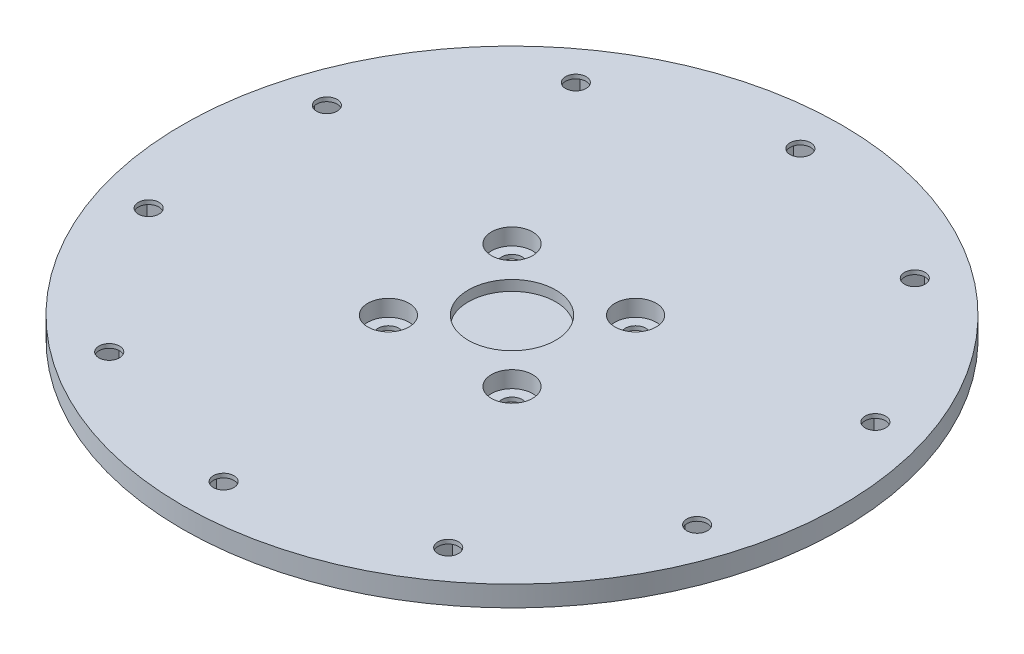
from build123d import *

# Parameters (mm, degrees)
SKETCH1_R           = 80
SKETCH1_R_2         = 2.5
BOSS_EXTRUDE1_DEPTH = 4
CUT_EXTRUDE1_DEPTH  = 114.207773585
SKETCH3_R           = 5
CUT_EXTRUDE2_DEPTH  = 3
BOSS_EXTRUDE2_START = 1
SKETCH4_R           = 80
SKETCH4_R_2         = 2.5
SKETCH4_R_3         = 5
BOSS_EXTRUDE2_DEPTH = 1
SKETCH5_R           = 10.6
CUT_EXTRUDE3_DEPTH  = 2.5


with BuildPart() as part:
    # Sketch1 → Boss-Extrude1 (new body)
    with BuildSketch(Plane(origin=(0, 0, 0), x_dir=(1, 0, 0), z_dir=(0, 1, 0))):
        with Locations(Location((0, 0, 0), (0, 0, 270))):
            Circle(SKETCH1_R)
        with Locations(Location((-15, 15, 0), (0, 0, 270))):
            Circle(SKETCH1_R_2, mode=Mode.SUBTRACT)
        with Locations(Location((15, 15, 0), (0, 0, 270))):
            Circle(SKETCH1_R_2, mode=Mode.SUBTRACT)
        with Locations(Location((15, -15, 0), (0, 0, 270))):
            Circle(SKETCH1_R_2, mode=Mode.SUBTRACT)
        with Locations(Location((-15, -15, 0), (0, 0, 270))):
            Circle(SKETCH1_R_2, mode=Mode.SUBTRACT)
    extrude(amount=BOSS_EXTRUDE1_DEPTH)

    # Sketch2 → Cut-Extrude1 (cut, through all)
    with BuildSketch(Plane(origin=(0, 4, 0), x_dir=(1, 0, 0), z_dir=(0, 1, 0))):
        Polygon((4, 72.309401077), (4, 67.690598923), (0, 65.381197846), (-4, 67.690598923), (-4, 72.309401077), (0, 74.618802154), align=None)
        Polygon((45.738467533, 56.148393315), (43.023603743, 52.411703879), (38.430103871, 52.89450017), (36.551467788, 57.113985897), (39.266331578, 60.850675333), (43.85983145, 60.367879042), align=None)
        Polygon((70.006395061, 18.540607721), (65.613653175, 17.113319362), (62.181214255, 20.203901247), (63.14151722, 24.721771492), (67.534259106, 26.149059851), (70.966698026, 23.058477965), align=None)
        Polygon((67.534259106, -26.149059851), (63.14151722, -24.721771492), (62.181214255, -20.203901247), (65.613653175, -17.113319362), (70.006395061, -18.540607721), (70.966698026, -23.058477965), align=None)
        Polygon((39.266331578, -60.850675333), (36.551467788, -57.113985897), (38.430103871, -52.89450017), (43.023603743, -52.411703879), (45.738467533, -56.148393315), (43.85983145, -60.367879042), align=None)
        Polygon((-4, -72.309401077), (-4, -67.690598923), (0, -65.381197846), (4, -67.690598923), (4, -72.309401077), (0, -74.618802154), align=None)
        Polygon((-45.738467533, -56.148393315), (-43.023603743, -52.411703879), (-38.430103871, -52.89450017), (-36.551467788, -57.113985897), (-39.266331578, -60.850675333), (-43.85983145, -60.367879042), align=None)
        Polygon((-70.006395061, -18.540607721), (-65.613653175, -17.113319362), (-62.181214255, -20.203901247), (-63.14151722, -24.721771492), (-67.534259106, -26.149059851), (-70.966698026, -23.058477965), align=None)
        Polygon((-67.534259106, 26.149059851), (-63.14151722, 24.721771492), (-62.181214255, 20.203901247), (-65.613653175, 17.113319362), (-70.006395061, 18.540607721), (-70.966698026, 23.058477965), align=None)
        Polygon((-39.266331578, 60.850675333), (-36.551467788, 57.113985897), (-38.430103871, 52.89450017), (-43.023603743, 52.411703879), (-45.738467533, 56.148393315), (-43.85983145, 60.367879042), align=None)
    extrude(amount=-CUT_EXTRUDE1_DEPTH, mode=Mode.SUBTRACT)

    # Sketch3 → Cut-Extrude2 (cut)
    with BuildSketch(Plane(origin=(0, 4, 0), x_dir=(1, 0, 0), z_dir=(0, 1, 0))):
        with Locations(Location((-15, -15, 0), (0, 0, 270))):
            Circle(SKETCH3_R)
        with Locations(Location((15, -15, 0), (0, 0, 270))):
            Circle(SKETCH3_R)
        with Locations(Location((15, 15, 0), (0, 0, 270))):
            Circle(SKETCH3_R)
        with Locations(Location((-15, 15, 0), (0, 0, 270))):
            Circle(SKETCH3_R)
    extrude(amount=-CUT_EXTRUDE2_DEPTH, mode=Mode.SUBTRACT)

    # Sketch4 → Boss-Extrude2 (add)
    with BuildSketch(Plane(origin=(0, 4, 0), x_dir=(1, 0, 0), z_dir=(0, 1, 0)).offset(BOSS_EXTRUDE2_START)):
        with Locations(Location((0, 0, 0), (0, 0, 270))):
            Circle(SKETCH4_R)
        with Locations(Location((41.14496766, 56.631189606, 0), (0, 0, 270))):
            Circle(SKETCH4_R_2, mode=Mode.SUBTRACT)
        with Locations(Location((0, 70, 0), (0, 0, 270))):
            Circle(SKETCH4_R_2, mode=Mode.SUBTRACT)
        with Locations(Location((66.573956141, 21.631189606, 0), (0, 0, 270))):
            Circle(SKETCH4_R_2, mode=Mode.SUBTRACT)
        with Locations(Location((66.573956141, -21.631189606, 0), (0, 0, 270))):
            Circle(SKETCH4_R_2, mode=Mode.SUBTRACT)
        with Locations(Location((-15, 15, 0), (0, 0, 270))):
            Circle(SKETCH4_R_3, mode=Mode.SUBTRACT)
        with Locations(Location((41.14496766, -56.631189606, 0), (0, 0, 270))):
            Circle(SKETCH4_R_2, mode=Mode.SUBTRACT)
        with Locations(Location((15, 15, 0), (0, 0, 270))):
            Circle(SKETCH4_R_3, mode=Mode.SUBTRACT)
        with Locations(Location((0, -70, 0), (0, 0, 270))):
            Circle(SKETCH4_R_2, mode=Mode.SUBTRACT)
        with Locations(Location((-15, -15, 0), (0, 0, 270))):
            Circle(SKETCH4_R_3, mode=Mode.SUBTRACT)
        with Locations(Location((-41.14496766, -56.631189606, 0), (0, 0, 270))):
            Circle(SKETCH4_R_2, mode=Mode.SUBTRACT)
        with Locations(Location((15, -15, 0), (0, 0, 270))):
            Circle(SKETCH4_R_3, mode=Mode.SUBTRACT)
        with Locations(Location((-66.573956141, -21.631189606, 0), (0, 0, 270))):
            Circle(SKETCH4_R_2, mode=Mode.SUBTRACT)
        with Locations(Location((-66.573956141, 21.631189606, 0), (0, 0, 270))):
            Circle(SKETCH4_R_2, mode=Mode.SUBTRACT)
        with Locations(Location((-41.14496766, 56.631189606, 0), (0, 0, 270))):
            Circle(SKETCH4_R_2, mode=Mode.SUBTRACT)
    extrude(amount=-BOSS_EXTRUDE2_DEPTH)

    # Sketch5 → Cut-Extrude3 (cut)
    with BuildSketch(Plane(origin=(0, 5, 0), x_dir=(1, 0, 0), z_dir=(0, 1, 0))):
        with Locations(Location((0, 0, 0), (0, 0, 270))):
            Circle(SKETCH5_R)
    extrude(amount=-CUT_EXTRUDE3_DEPTH, mode=Mode.SUBTRACT)


solid = part.part
